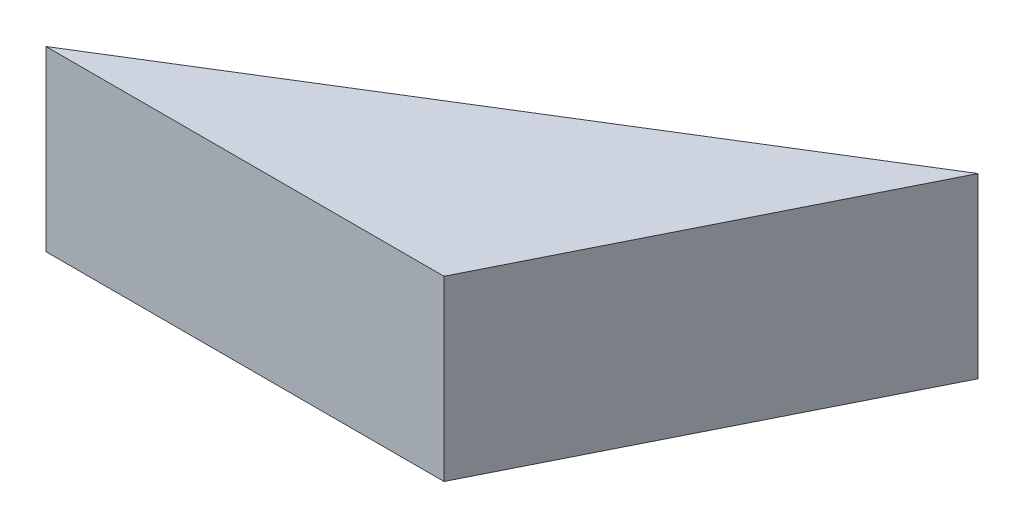
from build123d import *

# Parameters (mm, degrees)
BOSS_EXTRUDE1_DEPTH = 6


with BuildPart() as part:
    # Sketch1 → Boss-Extrude1 (new body)
    with BuildSketch(Plane(origin=(0, 0, 0), x_dir=(1, 0, 0), z_dir=(0, 1, 0))):
        Polygon((0, 0), (-13.434537667, 0), (6.009145751, 12.015696803), align=None)
    extrude(amount=BOSS_EXTRUDE1_DEPTH)


solid = part.part
